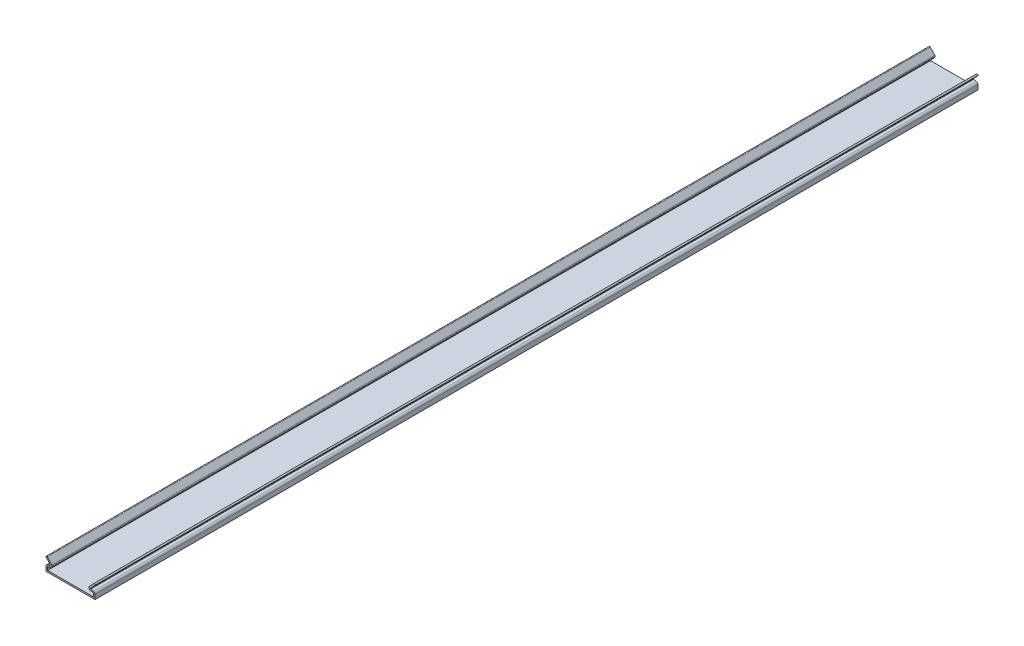
from build123d import *

# Parameters (mm, degrees)
BOSS_EXTRUDE1_DEPTH = 360


with BuildPart() as part:
    # Sketch1 → Boss-Extrude1 (new, symmetric)
    with BuildSketch(Plane.XY):
        with BuildLine():
            Line((46.962560252, -71.288832462), (46.962560252, -67.53553159))
            ThreePointArc((46.962560252, -67.53553159), (46.588231361, -66.507071414), (45.640397337, -65.959839185))
            Line((45.640397337, -65.959839185), (43.510465799, -65.584274788))
            ThreePointArc((43.510465799, -65.584274788), (43.278063156, -65.384023859), (43.343154142, -65.084232954))
            Line((43.343154142, -65.084232954), (46.795419695, -61.382131396))
            ThreePointArc((46.795419695, -61.382131396), (46.763338723, -60.463452556), (45.844659883, -60.495533528))
            Line((45.844659883, -60.495533528), (42.231206551, -64.370487816))
            ThreePointArc((42.231206551, -64.370487816), (42.032142684, -64.68598495), (41.962560252, -65.052486177))
            Line((41.962560252, -65.052486177), (41.962560252, -65.288832462))
            ThreePointArc((41.962560252, -65.288832462), (42.336889143, -66.317292637), (43.284723168, -66.864524867))
            Line((43.284723168, -66.864524867), (45.414654706, -67.240089264))
            ThreePointArc((45.414654706, -67.240089264), (45.592373585, -67.342695307), (45.662560252, -67.53553159))
            Line((45.662560252, -67.53553159), (45.662560252, -69.988832462))
            Line((45.662560252, -69.988832462), (8.262560252, -69.988832462))
            Line((8.262560252, -69.988832462), (8.262560252, -67.53553159))
            ThreePointArc((8.262560252, -67.53553159), (8.332746919, -67.342695307), (8.510465799, -67.240089264))
            Line((8.510465799, -67.240089264), (10.640397337, -66.864524867))
            ThreePointArc((10.640397337, -66.864524867), (11.588231361, -66.317292637), (11.962560252, -65.288832462))
            Line((11.962560252, -65.288832462), (11.962560252, -65.052486177))
            ThreePointArc((11.962560252, -65.052486177), (11.89297782, -64.68598495), (11.693913954, -64.370487816))
            Line((11.693913954, -64.370487816), (8.080460622, -60.495533528))
            ThreePointArc((8.080460622, -60.495533528), (7.161781782, -60.463452556), (7.12970081, -61.382131396))
            Line((7.12970081, -61.382131396), (10.581966363, -65.084232954))
            ThreePointArc((10.581966363, -65.084232954), (10.647057349, -65.384023859), (10.414654706, -65.584274788))
            Line((10.414654706, -65.584274788), (8.284723168, -65.959839185))
            ThreePointArc((8.284723168, -65.959839185), (7.336889143, -66.507071414), (6.962560252, -67.53553159))
            Line((6.962560252, -67.53553159), (6.962560252, -71.288832462))
            Line((6.962560252, -71.288832462), (46.962560252, -71.288832462))
        make_face()
    extrude(amount=BOSS_EXTRUDE1_DEPTH, both=True)


solid = part.part
